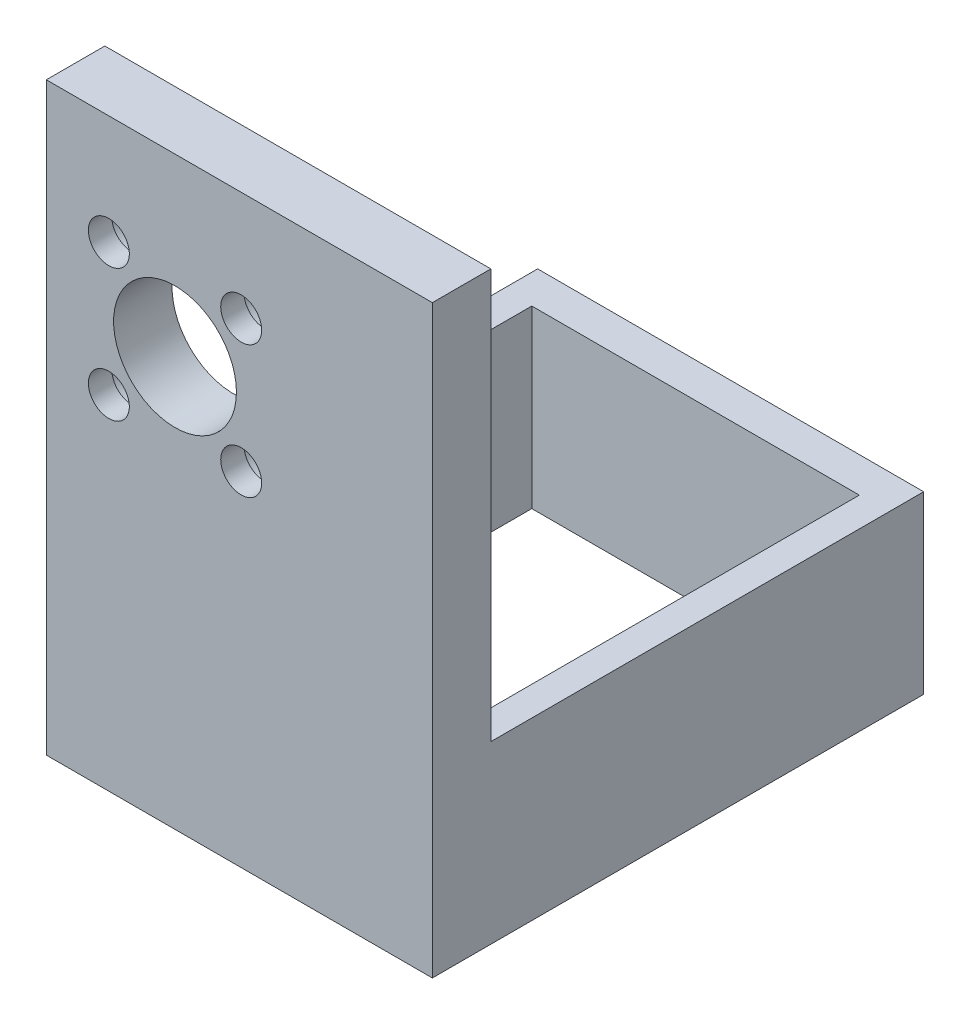
from build123d import *

# Parameters (mm, degrees)
SZKIC1_W                    = 33
SZKIC1_H                    = 15
DODANIE_WYCI_GNI_CIE1_DEPTH = 40
SZKIC2_W                    = 28
SZKIC2_H                    = 34
WYTNIJ_WYCI_GNI_CIE1_DEPTH  = 29
SZKIC3_W                    = 33
SZKIC3_H                    = 50
DODANIE_WYCI_GNI_CIE2_DEPTH = 2
SZKIC3_3_R                  = 4
WYTNIJ_WYCI_GNI_CIE2_DEPTH  = 16
SZKIC7_W                    = 33
SZKIC7_H                    = 50
DODANIE_WYCI_GNI_CIE3_DEPTH = 3
SZKIC3_5_R                  = 1.75
WYTNIJ_WYCI_GNI_CIE5_DEPTH  = 14.5
SZKIC3_6_R                  = 1.75
WYTNIJ_WYCI_GNI_CIE6_DEPTH  = 14.5
SZKIC3_7_R                  = 1.75
WYTNIJ_WYCI_GNI_CIE7_DEPTH  = 8.5
SZKIC5_R                    = 5.25
WYTNIJ_WYCI_GNI_CIE10_DEPTH = 36
SZKIC3_8_R                  = 1.75
WYTNIJ_WYCI_GNI_CIE8_DEPTH  = 5.5
SZKIC9_R                    = 2.5
WYTNIJ_WYCI_GNI_CIE11_DEPTH = 3
SZKIC9_4_R                  = 2.5
WYTNIJ_WYCI_GNI_CIE12_DEPTH = 3
SZKIC9_5_R                  = 2.5
WYTNIJ_WYCI_GNI_CIE13_DEPTH = 3
SZKIC9_6_R                  = 2.5
WYTNIJ_WYCI_GNI_CIE14_DEPTH = 3


with BuildPart() as part:
    # Szkic1 → Dodanie-wyciągnięcie1 (new body)
    with BuildSketch(Plane.XY):
        Rectangle(SZKIC1_W, SZKIC1_H)
    extrude(amount=DODANIE_WYCI_GNI_CIE1_DEPTH)

    # Szkic2 → Wytnij-wyciągnięcie1 (cut)
    with BuildSketch(Plane(origin=(0, 7.5, 0), x_dir=(1, 0, 0), z_dir=(0, 1, 0))):
        with Locations((0, -20)):
            Rectangle(SZKIC2_W, SZKIC2_H)
    extrude(amount=-WYTNIJ_WYCI_GNI_CIE1_DEPTH, mode=Mode.SUBTRACT)

    # Szkic3 → Dodanie-wyciągnięcie2 (add)
    with BuildSketch(Plane.XY.offset(40)):
        with Locations((0, 17.5)):
            Rectangle(SZKIC3_W, SZKIC3_H)
    extrude(amount=DODANIE_WYCI_GNI_CIE2_DEPTH)

    # Szkic3<3> → Wytnij-wyciągnięcie2 (cut)
    with BuildSketch(Plane.XY.offset(40)):
        with Locations((-5.5, 27.5)):
            Circle(SZKIC3_3_R)
    extrude(amount=WYTNIJ_WYCI_GNI_CIE2_DEPTH, mode=Mode.SUBTRACT)

    # Szkic7 → Dodanie-wyciągnięcie3 (add)
    with BuildSketch(Plane(origin=(0, 0, 40), x_dir=(-1, 0, 0), z_dir=(0, 0, -1))):
        with Locations((0, 17.5)):
            Rectangle(SZKIC7_W, SZKIC7_H)
    extrude(amount=DODANIE_WYCI_GNI_CIE3_DEPTH)

    # Szkic3<5> → Wytnij-wyciągnięcie5 (cut, symmetric)
    with BuildSketch(Plane.XY.offset(40)):
        with Locations((-11.156854249, 33.156854249)):
            Circle(SZKIC3_5_R)
    extrude(amount=WYTNIJ_WYCI_GNI_CIE5_DEPTH, both=True, mode=Mode.SUBTRACT)

    # Szkic3<6> → Wytnij-wyciągnięcie6 (cut, symmetric)
    with BuildSketch(Plane.XY.offset(40)):
        with Locations((-11.156854249, 21.843145751)):
            Circle(SZKIC3_6_R)
    extrude(amount=WYTNIJ_WYCI_GNI_CIE6_DEPTH, both=True, mode=Mode.SUBTRACT)

    # Szkic3<7> → Wytnij-wyciągnięcie7 (cut, symmetric)
    with BuildSketch(Plane.XY.offset(40)):
        with Locations((0.156854249, 33.156854249)):
            Circle(SZKIC3_7_R)
    extrude(amount=WYTNIJ_WYCI_GNI_CIE7_DEPTH, both=True, mode=Mode.SUBTRACT)

    # Szkic5 → Wytnij-wyciągnięcie10 (cut)
    with BuildSketch(Plane.XY.offset(42)):
        with Locations((-5.5, 27.5)):
            Circle(SZKIC5_R)
    extrude(amount=-WYTNIJ_WYCI_GNI_CIE10_DEPTH, mode=Mode.SUBTRACT)

    # Szkic3<8> → Wytnij-wyciągnięcie8 (cut, symmetric)
    with BuildSketch(Plane.XY.offset(40)):
        with Locations((0.156854249, 21.843145751)):
            Circle(SZKIC3_8_R)
    extrude(amount=WYTNIJ_WYCI_GNI_CIE8_DEPTH, both=True, mode=Mode.SUBTRACT)

    # Szkic9 → Wytnij-wyciągnięcie11 (cut)
    with BuildSketch(Plane(origin=(0, 0, 37), x_dir=(-1, 0, 0), z_dir=(0, 0, -1))):
        with Locations((-0.156854249, 33.156854249)):
            Circle(SZKIC9_R)
    extrude(amount=-WYTNIJ_WYCI_GNI_CIE11_DEPTH, mode=Mode.SUBTRACT)

    # Szkic9<4> → Wytnij-wyciągnięcie12 (cut)
    with BuildSketch(Plane(origin=(0, 0, 37), x_dir=(-1, 0, 0), z_dir=(0, 0, -1))):
        with Locations((11.156854249, 33.156854249)):
            Circle(SZKIC9_4_R)
    extrude(amount=-WYTNIJ_WYCI_GNI_CIE12_DEPTH, mode=Mode.SUBTRACT)

    # Szkic9<5> → Wytnij-wyciągnięcie13 (cut)
    with BuildSketch(Plane(origin=(0, 0, 37), x_dir=(-1, 0, 0), z_dir=(0, 0, -1))):
        with Locations((11.156854249, 21.843145751)):
            Circle(SZKIC9_5_R)
    extrude(amount=-WYTNIJ_WYCI_GNI_CIE13_DEPTH, mode=Mode.SUBTRACT)

    # Szkic9<6> → Wytnij-wyciągnięcie14 (cut)
    with BuildSketch(Plane(origin=(0, 0, 37), x_dir=(-1, 0, 0), z_dir=(0, 0, -1))):
        with Locations((-0.156854249, 21.843145751)):
            Circle(SZKIC9_6_R)
    extrude(amount=-WYTNIJ_WYCI_GNI_CIE14_DEPTH, mode=Mode.SUBTRACT)


solid = part.part
